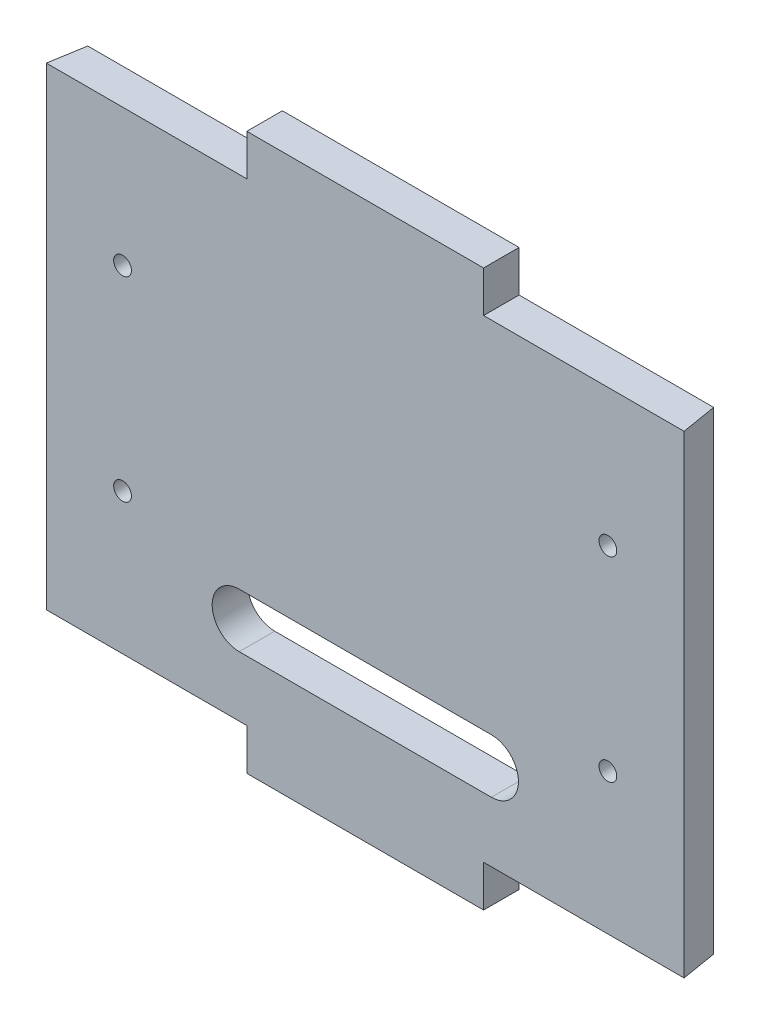
from build123d import *

# Parameters (mm, degrees)
BOSS_EXTRUDE1_DEPTH = 3
SKETCH1_W           = 20
SKETCH1_H           = 3
BOSS_EXTRUDE2_DEPTH = 2
SKETCH2_W           = 20
SKETCH2_H           = 3
BOSS_EXTRUDE3_DEPTH = 2
CUT_EXTRUDE4_DEPTH  = 44
SKETCH4_R           = 0.75
CUT_EXTRUDE5_DEPTH  = 16
CUT_EXTRUDE6_DEPTH  = 16


with BuildPart() as part:
    # Model → Boss-Extrude1 (new body)
    with BuildSketch(Plane.XY):
        Polygon((70.216761418, 10.802709547), (53.276888396, 10.802709547), (53.276888396, 9.302709547), (33.276888396, 9.302709547), (33.276888396, 10.802709547), (16.337015373, 10.802709547), (16.337015373, 50.802709547), (33.276888396, 50.802709547), (33.276888396, 52.283127555), (53.276888396, 52.283127555), (53.276888396, 50.802709547), (70.216761418, 50.802709547), align=None)
    extrude(amount=BOSS_EXTRUDE1_DEPTH)

    # Sketch1 → Boss-Extrude2 (add)
    with BuildSketch(Plane.XZ.offset(-9.302709547)):
        with Locations((43.276888396, 1.5)):
            Rectangle(SKETCH1_W, SKETCH1_H)
    extrude(amount=BOSS_EXTRUDE2_DEPTH)

    # Sketch2 → Boss-Extrude3 (add)
    with BuildSketch(Plane(origin=(0, 52.283127555, 0), x_dir=(1, 0, 0), z_dir=(0, 1, 0))):
        with Locations((43.276888396, -1.5)):
            Rectangle(SKETCH2_W, SKETCH2_H)
    extrude(amount=BOSS_EXTRUDE3_DEPTH)

    # Sketch3 → Cut-Extrude4 (cut)
    with BuildSketch(Plane(origin=(0, 50.802709547, 0), x_dir=(1, 0, 0), z_dir=(0, 1, 0))):
        Polygon((70.216761418, 0), (69.716761418, 0), (70.216761418, -3), align=None)
        Polygon((16.337015373, -3), (16.337015373, 0), (16.837015373, 0), align=None)
    extrude(amount=-CUT_EXTRUDE4_DEPTH, mode=Mode.SUBTRACT)

    # Sketch4 → Cut-Extrude5 (cut)
    with BuildSketch(Plane.XY.offset(3)):
        with Locations((22.776888396, 39.218622605)):
            Circle(SKETCH4_R)
        with Locations((22.776888396, 22.718622605)):
            Circle(SKETCH4_R)
        with Locations(Location((63.776888396, 22.718622605, 0), (0, 0, 180))):
            Circle(SKETCH4_R)
        with Locations(Location((63.776888396, 39.218622605, 0), (0, 0, 180))):
            Circle(SKETCH4_R)
    extrude(amount=-CUT_EXTRUDE5_DEPTH, mode=Mode.SUBTRACT)

    # Sketch5 → Cut-Extrude6 (cut)
    with BuildSketch(Plane.XY.offset(3)):
        with BuildLine():
            Line((32.633411635, 20.459880451), (53.935807441, 20.459880451))
            ThreePointArc((53.935807441, 20.459880451), (56.222748266, 18.172939626), (53.935807441, 15.885998802))
            Line((53.935807441, 15.885998802), (32.633411635, 15.885998802))
            ThreePointArc((32.633411635, 15.885998802), (30.34647081, 18.172939626), (32.633411635, 20.459880451))
        make_face()
    extrude(amount=-CUT_EXTRUDE6_DEPTH, mode=Mode.SUBTRACT)


solid = part.part
